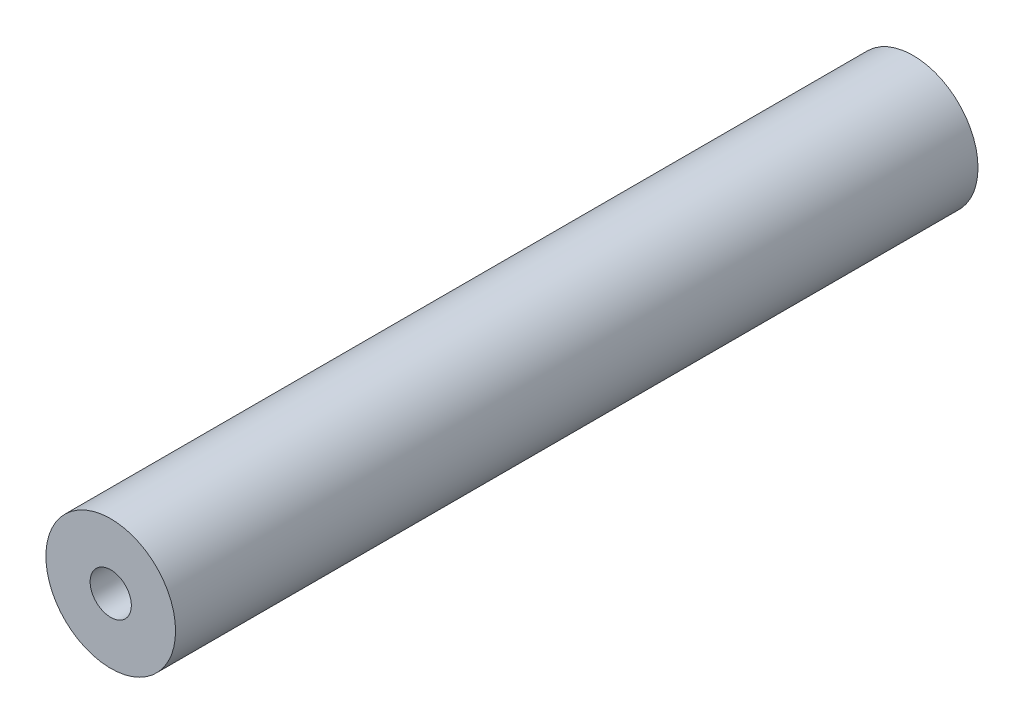
from build123d import *

# Parameters (mm, degrees)
SKETCH1_R                            = 6.35
BOSS_EXTRUDE1_DEPTH                  = 39.290625
F_10_32_TAPPED_HOLE1_D               = 4.0386
F_10_32_TAPPED_HOLE1_DEPTH           = 12.02944
F_10_32_TAPPED_HOLE1_TIP             = 1.213317848
F_10_32_TAPPED_HOLE1_ON_FACE_2_D     = 4.0386
F_10_32_TAPPED_HOLE1_ON_FACE_2_DEPTH = 12.02944
F_10_32_TAPPED_HOLE1_ON_FACE_2_TIP   = 1.213317848


with BuildPart() as part:
    # Sketch1 → Boss-Extrude1 (new, symmetric)
    with BuildSketch(Plane.XY):
        Circle(SKETCH1_R)
    extrude(amount=BOSS_EXTRUDE1_DEPTH, both=True)

    # #10-32 Tapped Hole1
    with Locations(Plane(origin=(0, 0, -39.290625), x_dir=(-1, 0, 0), z_dir=(0, 0, -1))):
        with Locations((0, 0)):
            Hole(F_10_32_TAPPED_HOLE1_D / 2, depth=F_10_32_TAPPED_HOLE1_DEPTH)
            with Locations((0, 0, -(F_10_32_TAPPED_HOLE1_DEPTH + F_10_32_TAPPED_HOLE1_TIP / 2))):  # 118° drill point
                Cone(0, F_10_32_TAPPED_HOLE1_D / 2, F_10_32_TAPPED_HOLE1_TIP, mode=Mode.SUBTRACT)

    # #10-32 Tapped Hole1 on face 2
    with Locations(Plane.XY.offset(39.290625)):
        with Locations((0, 0)):
            Hole(F_10_32_TAPPED_HOLE1_ON_FACE_2_D / 2, depth=F_10_32_TAPPED_HOLE1_ON_FACE_2_DEPTH)
            with Locations((0, 0, -(F_10_32_TAPPED_HOLE1_ON_FACE_2_DEPTH + F_10_32_TAPPED_HOLE1_ON_FACE_2_TIP / 2))):  # 118° drill point
                Cone(0, F_10_32_TAPPED_HOLE1_ON_FACE_2_D / 2, F_10_32_TAPPED_HOLE1_ON_FACE_2_TIP, mode=Mode.SUBTRACT)


solid = part.part
